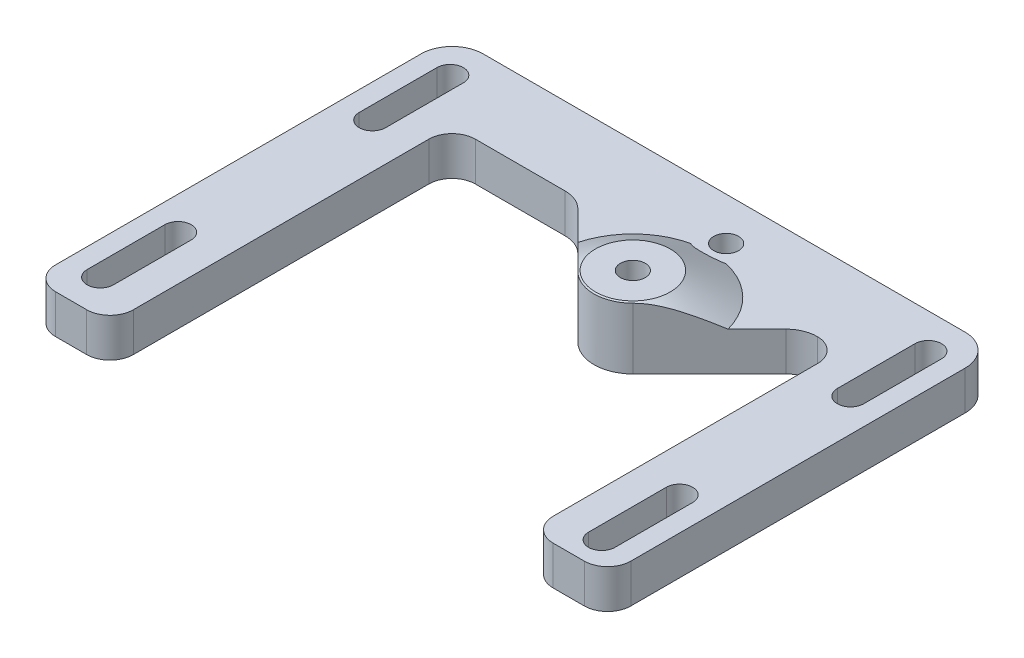
from build123d import *

# Parameters (mm, degrees)
SKETCH2_R           = 1.6
BOSS_EXTRUDE1_DEPTH = 5
SKETCH3_R           = 10
BOSS_EXTRUDE2_DEPTH = 3
BOSS_EXTRUDE2_TAPER = 60
CUT_EXTRUDE1_REACH  = 63.555
SKETCH4_R           = 1.6
SKETCH5_R           = 3.5
CUT_EXTRUDE2_DEPTH  = 3
SKETCH6_R           = 3.2
CUT_EXTRUDE3_DEPTH  = 3


with BuildPart() as part:
    # Sketch2 → Boss-Extrude1 (new body)
    with BuildSketch(Plane(origin=(0, 0, 0), x_dir=(1, 0, 0), z_dir=(0, 1, 0))):
        with BuildLine():
            Line((-25, 0), (-25, 37))
            ThreePointArc((-25, 37), (-24.121320344, 39.121320344), (-22, 40))
            Line((-22, 40), (-10.477922061, 40))
            ThreePointArc((-10.477922061, 40), (-8.947188332, 39.69551813), (-7.649494937, 38.828427125))
            Line((-7.649494937, 38.828427125), (2.214466094, 28.964466094))
            ThreePointArc((2.214466094, 28.964466094), (5.75, 27.5), (9.285533906, 28.964466094))
            Line((9.285533906, 28.964466094), (19.149494937, 38.828427125))
            ThreePointArc((19.149494937, 38.828427125), (20.447188332, 39.69551813), (21.977922061, 40))
            Line((21.977922061, 40), (22, 40))
            ThreePointArc((22, 40), (24.121320344, 39.121320344), (25, 37))
            Line((25, 37), (25, 3))
            ThreePointArc((25, 3), (25.878679656, 0.878679656), (28, 0))
            Line((28, 0), (32, 0))
            ThreePointArc((32, 0), (34.121320344, 0.878679656), (35, 3))
            Line((35, 3), (35, 46))
            ThreePointArc((35, 46), (33.828427125, 48.828427125), (31, 50))
            Line((31, 50), (-31, 50))
            ThreePointArc((-31, 50), (-33.828427125, 48.828427125), (-35, 46))
            Line((-35, 46), (-35, 0))
            Line((-35, 0), (-35, -1))
            ThreePointArc((-35, -1), (-34.121320344, -3.121320344), (-32, -4))
            Line((-32, -4), (-28, -4))
            ThreePointArc((-28, -4), (-25.878679656, -3.121320344), (-25, -1))
            Line((-25, -1), (-25, 0))
        make_face()
        with Locations(Location((5.75, 32.5, 0), (0, 0, 270))):
            Circle(SKETCH2_R, mode=Mode.SUBTRACT)
        with BuildLine():
            Line((32.45, 45.5), (32.45, 35.5))
            ThreePointArc((32.45, 35.5), (30.75, 33.8), (29.05, 35.5))
            Line((29.05, 35.5), (29.05, 45.5))
            ThreePointArc((29.05, 45.5), (30.75, 47.2), (32.45, 45.5))
        make_face(mode=Mode.SUBTRACT)
        with BuildLine():
            Line((32.45, 13.5), (32.45, 3.5))
            ThreePointArc((32.45, 3.5), (30.75, 1.8), (29.05, 3.5))
            Line((29.05, 3.5), (29.05, 13.5))
            ThreePointArc((29.05, 13.5), (30.75, 15.2), (32.45, 13.5))
        make_face(mode=Mode.SUBTRACT)
        with BuildLine():
            Line((-29.05, 45.5), (-29.05, 35.5))
            ThreePointArc((-29.05, 35.5), (-30.75, 33.8), (-32.45, 35.5))
            Line((-32.45, 35.5), (-32.45, 45.5))
            ThreePointArc((-32.45, 45.5), (-30.75, 47.2), (-29.05, 45.5))
        make_face(mode=Mode.SUBTRACT)
        with BuildLine():
            Line((-29.05, 10.5), (-29.05, 0.5))
            ThreePointArc((-29.05, 0.5), (-30.75, -1.2), (-32.45, 0.5))
            Line((-32.45, 0.5), (-32.45, 10.5))
            ThreePointArc((-32.45, 10.5), (-30.75, 12.2), (-29.05, 10.5))
        make_face(mode=Mode.SUBTRACT)
    extrude(amount=BOSS_EXTRUDE1_DEPTH)

    # Sketch3 → Boss-Extrude2 (add)
    with BuildSketch(Plane(origin=(0, 5, 0), x_dir=(1, 0, 0), z_dir=(0, 1, 0))):
        with Locations((5.75, 32.5)):
            Circle(SKETCH3_R)
    extrude(amount=BOSS_EXTRUDE2_DEPTH, taper=BOSS_EXTRUDE2_TAPER)

    # Sketch4 → Cut-Extrude1 (cut, up to next)
    with BuildSketch(Plane.XZ, mode=Mode.PRIVATE) as cut_extrude1_sk1:
        with Locations(Location((5.75, -32.5, 0), (0, 0, 90))):
            Circle(SKETCH4_R)
    cut_extrude1_tool1 = extrude(cut_extrude1_sk1.sketch, amount=-CUT_EXTRUDE1_REACH, mode=Mode.PRIVATE) & part.part
    # Sketch4 → Cut-Extrude1 (cut, up to next)
    with BuildSketch(Plane.XZ, mode=Mode.PRIVATE) as cut_extrude1_sk2:
        with Locations(Location((5.75, -44.5, 0), (0, 0, 270))):
            Circle(SKETCH4_R)
    cut_extrude1_tool2 = extrude(cut_extrude1_sk2.sketch, amount=-CUT_EXTRUDE1_REACH, mode=Mode.PRIVATE) & part.part
    # Sketch4 → Cut-Extrude1 (cut, up to next)
    with BuildSketch(Plane.XZ, mode=Mode.PRIVATE) as cut_extrude1_sk3:
        with BuildLine():
            Line((-3.909258263, -35.088190451), (2.214466094, -28.964466094))
            ThreePointArc((2.214466094, -28.964466094), (5.75, -27.5), (9.285533906, -28.964466094))
            Line((9.285533906, -28.964466094), (15.409258263, -35.088190451))
            ThreePointArc((15.409258263, -35.088190451), (5.75, -22.5), (-3.909258263, -35.088190451))
        make_face()
    cut_extrude1_tool3 = extrude(cut_extrude1_sk3.sketch, amount=-CUT_EXTRUDE1_REACH, mode=Mode.PRIVATE) & part.part
    add(cut_extrude1_tool1.solids().sort_by_distance((5.75, 0, -32.5))[0], mode=Mode.SUBTRACT)
    add(cut_extrude1_tool2.solids().sort_by_distance((5.75, 0, -44.5))[0], mode=Mode.SUBTRACT)
    add(cut_extrude1_tool3.solids().sort_by_distance((12.514498, 0, -31.859226))[0], mode=Mode.SUBTRACT)

    # Sketch5 → Cut-Extrude2 (cut)
    with BuildSketch(Plane.XZ):
        with Locations(Location((5.75, -32.5, 0), (0, 0, 270))):
            Circle(SKETCH5_R)
    extrude(amount=-CUT_EXTRUDE2_DEPTH, mode=Mode.SUBTRACT)

    # Sketch6 → Cut-Extrude3 (cut)
    with BuildSketch(Plane(origin=(0, 5, 0), x_dir=(1, 0, 0), z_dir=(0, 1, 0))):
        with Locations((5.75, 44.5)):
            Circle(SKETCH6_R)
    extrude(amount=CUT_EXTRUDE3_DEPTH, mode=Mode.SUBTRACT)


solid = part.part
